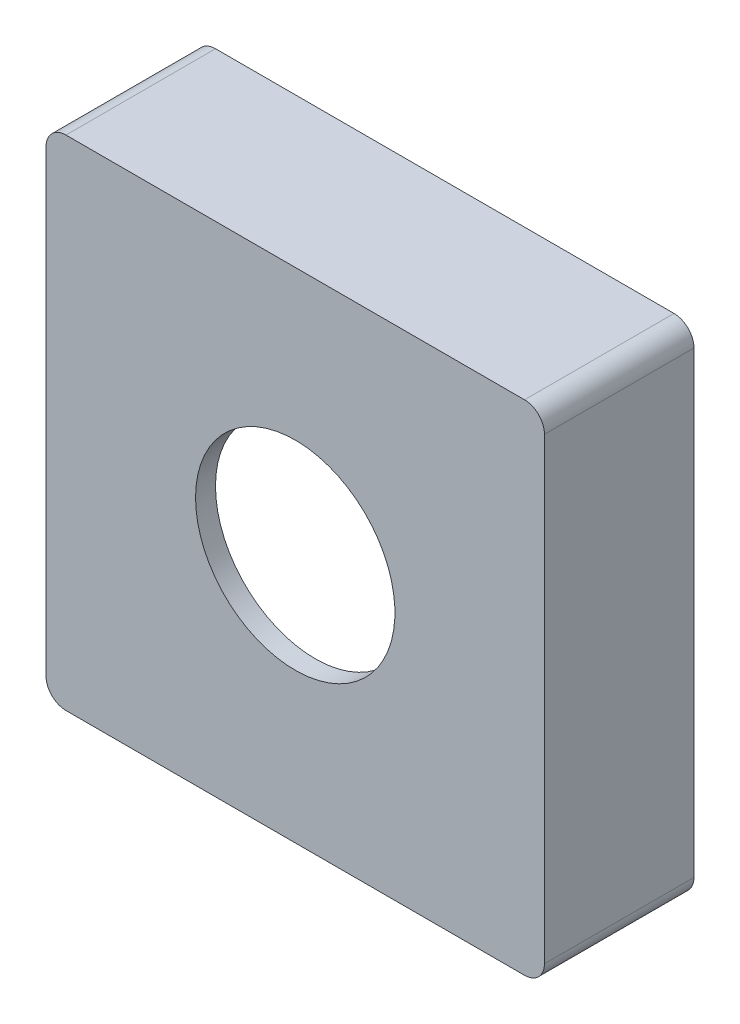
from build123d import *

# Parameters (mm, degrees)
SKETCH1_W               = 50
SKETCH1_H               = 50
BOSS_EXTRUDE1_DEPTH     = 15
SHELL2_T                = -2
CUT_EXTRUDE1_DEPTH      = 39.405728739
CUT_EXTRUDE1_DEPTH_BACK = 39.405728739
SKETCH3_R               = 10
FILLET1_R               = 2
FILLET3_R               = 2
SKETCH5_R               = 2.5
SKETCH5_R_2             = 1.5
BOSS_EXTRUDE2_DEPTH     = 3
LPATTERN2_COUNT         = 2
LPATTERN2_PITCH         = 20
LPATTERN2_COUNT_DIR2    = 2
LPATTERN2_PITCH_DIR2    = 35


with BuildPart() as part:
    # Sketch1 → Boss-Extrude1 (new body)
    with BuildSketch(Plane(origin=(0, 0, 0), x_dir=(0, 1, 0), z_dir=(0, 0, 1))):
        Rectangle(SKETCH1_W, SKETCH1_H)
    extrude(amount=BOSS_EXTRUDE1_DEPTH)

    # Shell2
    shell2_openings = [part.faces().sort_by_distance(p)[0] for p in [
        (0, 0, 0),
    ]]
    offset(amount=SHELL2_T, openings=shell2_openings, kind=Kind.INTERSECTION)

    # Sketch3 → Cut-Extrude1 (cut, two sides: drawn at the far end of the back side and taken through both)
    with BuildSketch(Plane.XY.offset(15).offset(-CUT_EXTRUDE1_DEPTH_BACK)):
        with Locations(Location((0, 0, 0), (0, 0, 180))):
            Circle(SKETCH3_R)
    extrude(amount=CUT_EXTRUDE1_DEPTH + CUT_EXTRUDE1_DEPTH_BACK, mode=Mode.SUBTRACT)

    # Fillet1
    fillet1_edges = [part.edges().sort_by_distance(p)[0] for p in [
        (23, 23, 6.5),
        (-23, 23, 6.5),
        (-23, -23, 6.5),
        (23, -23, 6.5),
    ]]
    fillet(fillet1_edges, radius=FILLET1_R)

    # Fillet3
    fillet3_edges = [part.edges().sort_by_distance(p)[0] for p in [
        (25, 25, 7.5),
        (25, -25, 7.5),
        (-25, -25, 7.5),
        (-25, 25, 7.5),
    ]]
    fillet(fillet3_edges, radius=FILLET3_R)

    # Sketch5 → Boss-Extrude2 (add)
    with BuildSketch(Plane(origin=(0, 0, 13), x_dir=(1, 0, 0), z_dir=(0, 0, -1))):
        with Locations(Location((17.5, 10, 0), (0, 0, 180))):
            Circle(SKETCH5_R)
        with Locations(Location((17.5, 10, 0), (0, 0, 180))):
            Circle(SKETCH5_R_2, mode=Mode.SUBTRACT)
    boss_extrude2 = extrude(amount=BOSS_EXTRUDE2_DEPTH)

    # LPattern2: Boss-Extrude2 2 × 2
    with Locations(*[(-j * LPATTERN2_PITCH_DIR2, i * LPATTERN2_PITCH, 0) for i in range(LPATTERN2_COUNT) for j in range(LPATTERN2_COUNT_DIR2) if (i, j) != (0, 0)]):
        add(boss_extrude2)


solid = part.part
